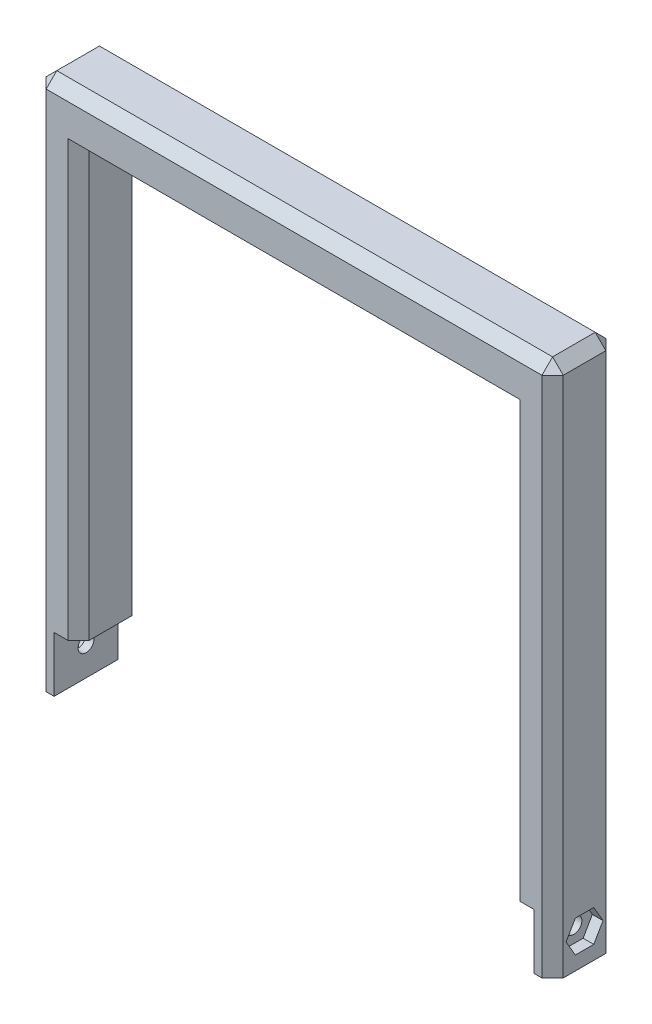
from build123d import *

# Parameters (mm, degrees)
SKETCH1_W             = 3.5
SKETCH1_H             = 12
BOSS_EXTRUDE1_DEPTH   = 100
BOSS_EXTRUDE1_2_DEPTH = 100
SKETCH2_W             = 12
SKETCH2_H             = 10
BOSS_EXTRUDE2_DEPTH   = 90.08829946
SKETCH3_W             = 4.58560389
SKETCH3_H             = 12
BOSS_EXTRUDE3_DEPTH   = 79.6
CHAMFER6_SIZE         = 2
CUT_EXTRUDE1_DEPTH    = 2
CUT_EXTRUDE2_REACH    = 140.122
SKETCH5_R             = 1.5


with BuildPart() as part:
    # Sketch1 → Boss-Extrude1 (new body)
    with BuildSketch(Plane(origin=(0, 0, 0), x_dir=(1, 0, 0), z_dir=(0, 1, 0))):
        with Locations((-46.79414973, 0)):
            Rectangle(SKETCH1_W, SKETCH1_H)
    extrude(amount=BOSS_EXTRUDE1_DEPTH)



with BuildPart() as body_2:
    # Sketch1 → Boss-Extrude1 2 (new body)
    with BuildSketch(Plane(origin=(0, 0, 0), x_dir=(1, 0, 0), z_dir=(0, 1, 0))):
        with Locations((46.79414973, 0)):
            Rectangle(SKETCH1_W, SKETCH1_H)
    extrude(amount=BOSS_EXTRUDE1_2_DEPTH)


with BuildPart() as part_1:
    add(part.part)

    add(body_2.part)  # Boss-Extrude2 merges body 2
    # Sketch2 → Boss-Extrude2 (add)
    with BuildSketch(Plane(origin=(-45.04414973, 0, 0), x_dir=(0, 0, -1), z_dir=(1, 0, 0))):
        with Locations((0, 95)):
            Rectangle(SKETCH2_W, SKETCH2_H)
    extrude(amount=BOSS_EXTRUDE2_DEPTH)

    # Sketch3 → Boss-Extrude3 (add)
    with BuildSketch(Plane.XZ.offset(-90)):
        with Locations((-42.751347785, 0)):
            Rectangle(SKETCH3_W, SKETCH3_H)
        with Locations((42.751347785, 0)):
            Rectangle(SKETCH3_W, SKETCH3_H)
    extrude(amount=BOSS_EXTRUDE3_DEPTH)

    # Chamfer6
    chamfer6_edges = [part_1.edges().sort_by_distance(p)[0] for p in [
        (0, 100, 6),
        (48.54414973, 50, 6),
        (48.54414973, 50, -6),
        (48.54414973, 100, 0),
        (0, 100, -6),
        (-40.45854584, 50.2, -6),
        (-40.45854584, 50.2, 6),
        (0, 90, 6),
        (0, 90, -6),
        (40.45854584, 50.2, 6),
        (40.45854584, 50.2, -6),
        (-48.54414973, 50, 6),
        (-48.54414973, 50, -6),
        (-48.54414973, 100, 0),
    ]]
    chamfer(chamfer6_edges, length=CHAMFER6_SIZE)

    # Sketch4 → Cut-Extrude1 (cut)
    with BuildSketch(Plane(origin=(48.54414973, 0, 0), x_dir=(0, 0, -1), z_dir=(1, 0, 0))):
        Polygon((3.464101615, 5.6), (1.732050808, 8.6), (-1.732050808, 8.6), (-3.464101615, 5.6), (-1.732050808, 2.6), (1.732050808, 2.6), align=None)
    cut_extrude1 = extrude(amount=-CUT_EXTRUDE1_DEPTH, mode=Mode.SUBTRACT)

    # Mirror1: Cut-Extrude1 across plane
    add(cut_extrude1.mirror(Plane(origin=(0, 0, 0), x_dir=(0, 0, 1), z_dir=(1, 0, 0))), mode=Mode.SUBTRACT)

    # Cut-Extrude2: up to this face of the body (flat: up to its plane)
    cut_extrude2_end = Plane(part_1.part.faces().sort_by_distance((-46.54414973, 5.6, 0))[0])
    # Sketch5 → Cut-Extrude2 (cut, up to the picked face)
    with BuildSketch(Plane(origin=(46.54414973, 0, 0), x_dir=(0, 0, -1), z_dir=(1, 0, 0)), mode=Mode.PRIVATE) as cut_extrude2_sk1:
        with Locations((0, 5.6)):
            Circle(SKETCH5_R)
    cut_extrude2_tool1 = split(extrude(cut_extrude2_sk1.sketch, amount=-CUT_EXTRUDE2_REACH, mode=Mode.PRIVATE), bisect_by=cut_extrude2_end, keep=Keep.BOTH, mode=Mode.PRIVATE)
    add(cut_extrude2_tool1.solids().sort_by(Axis((46.54415, 5.6, 0), (-1, 0, 0)))[0], mode=Mode.SUBTRACT)


solid = part_1.part
